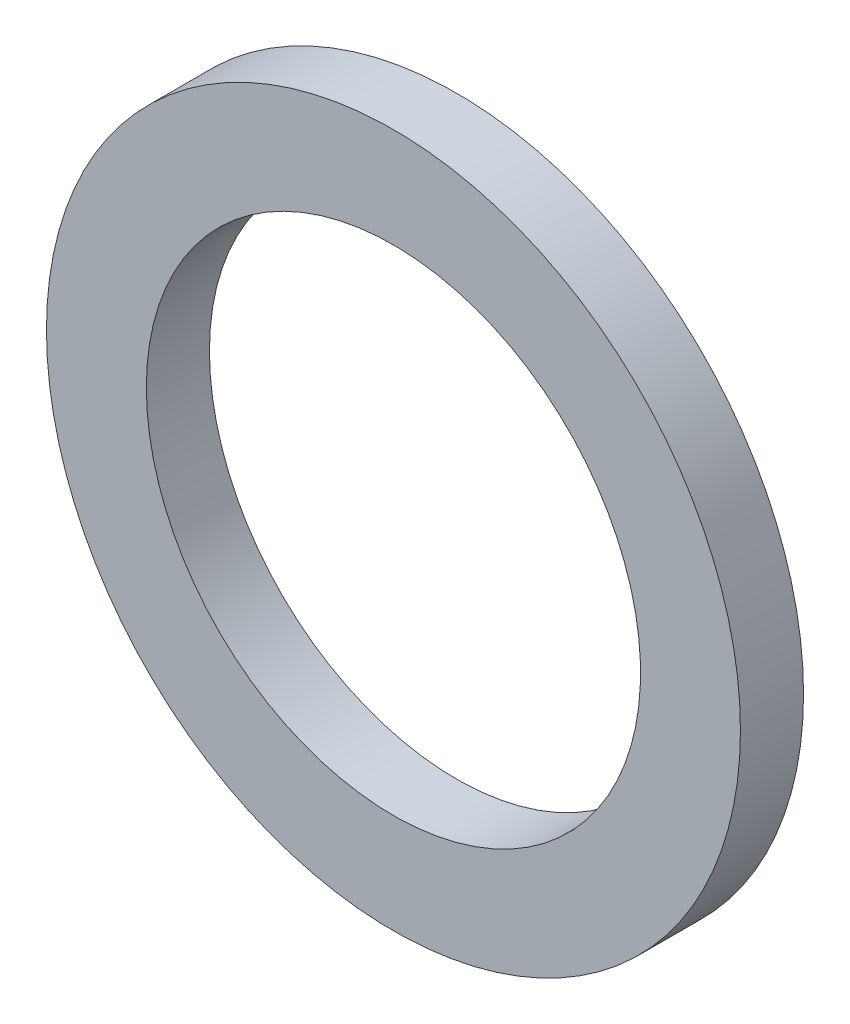
from build123d import *

# Parameters (mm, degrees)
SKETCH1_R          = 8.382
SKETCH1_R_2        = 5.969
BASE_EXTRUDE_DEPTH = 1.524


with BuildPart() as part:
    # Sketch1 → Base-Extrude (new body)
    with BuildSketch(Plane.XY):
        with Locations(Location((0, 0, 0), (0, 0, 180))):
            Circle(SKETCH1_R)
        with Locations(Location((0, 0, 0), (0, 0, 180))):
            Circle(SKETCH1_R_2, mode=Mode.SUBTRACT)
    extrude(amount=BASE_EXTRUDE_DEPTH)


solid = part.part
